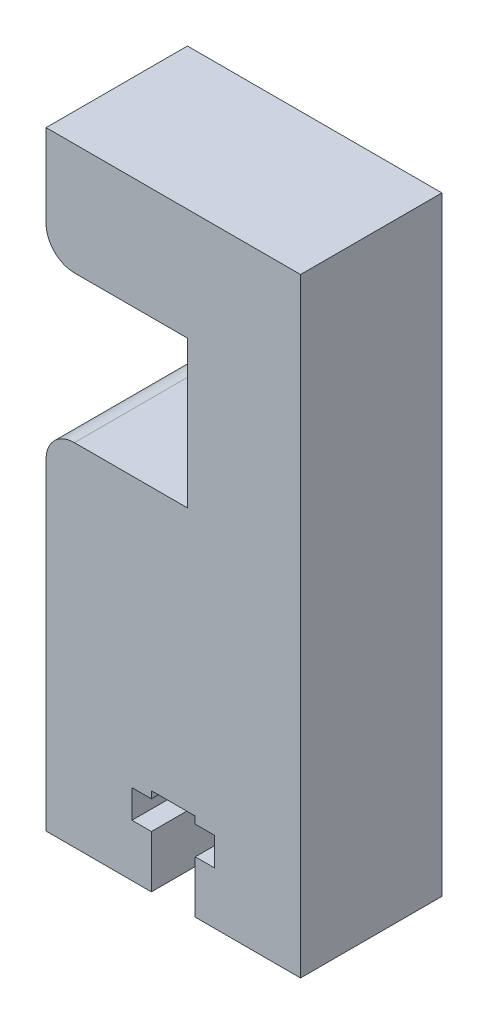
from build123d import *

# Parameters (mm, degrees)
DODANIE_WYCI_GNI_CIE1_DEPTH = 10
WYTNIJ_WYCI_GNI_CIE1_DEPTH  = 10


with BuildPart() as part:
    # Szkic1 → Dodanie-wyciągnięcie1 (new body)
    with BuildSketch(Plane.XY):
        with BuildLine():
            Line((-39.146316842, 3.9), (-57.146316842, 3.9))
            Line((-57.146316842, 3.9), (-57.146316842, 26.7))
            ThreePointArc((-57.146316842, 26.7), (-56.560530404, 28.114213562), (-55.146316842, 28.7))
            Line((-55.146316842, 28.7), (-47.146316842, 28.7))
            Line((-47.146316842, 28.7), (-47.146316842, 39.1))
            Line((-47.146316842, 39.1), (-55.146316842, 39.1))
            ThreePointArc((-55.146316842, 39.1), (-56.560530404, 39.685786438), (-57.146316842, 41.1))
            Line((-57.146316842, 41.1), (-57.146316842, 47))
            Line((-57.146316842, 47), (-39.146316842, 47))
            Line((-39.146316842, 47), (-39.146316842, 3.9))
        make_face()
    extrude(amount=DODANIE_WYCI_GNI_CIE1_DEPTH)

    # Szkic2 → Wytnij-wyciągnięcie1 (cut)
    with BuildSketch(Plane.XY.offset(10)):
        Polygon((-46.596316842, 3.9), (-46.596316842, 7.6), (-45.221316842, 7.6), (-45.221316842, 9.6), (-46.596316842, 9.6), (-46.596316842, 10.1), (-49.696316842, 10.1), (-49.696316842, 9.6), (-51.071316842, 9.6), (-51.071316842, 7.6), (-49.696316842, 7.6), (-49.696316842, 3.9), align=None)
    extrude(amount=-WYTNIJ_WYCI_GNI_CIE1_DEPTH, mode=Mode.SUBTRACT)


solid = part.part
